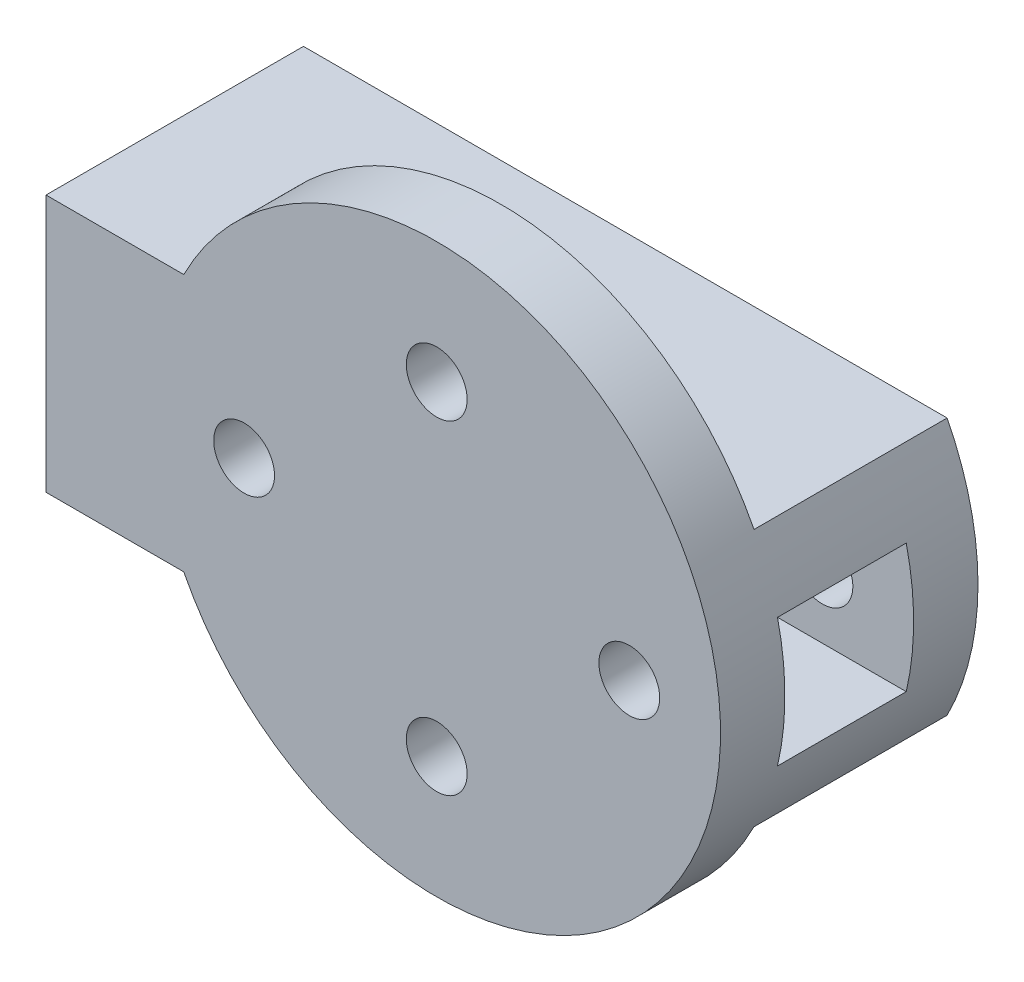
from build123d import *

# Parameters (mm, degrees)
SKETCH1_R           = 14
BOSS_EXTRUDE1_DEPTH = 3.175
BOSS_EXTRUDE2_START = 12.7
BOSS_EXTRUDE2_DEPTH = 12.7
SKETCH3_W           = 6.35
SKETCH3_H           = 6.35
CUT_EXTRUDE1_DEPTH  = 38.333803689
SKETCH4_R           = 1.5
CUT_EXTRUDE2_DEPTH  = 27.995101119


with BuildPart() as part:
    # Sketch1 → Boss-Extrude1 (new body)
    with BuildSketch(Plane.XY):
        Circle(SKETCH1_R)
    extrude(amount=BOSS_EXTRUDE1_DEPTH)

    # Sketch2 → Boss-Extrude2 (add)
    with BuildSketch(Plane(origin=(0, 0, 3.175), x_dir=(-1, 0, 0), z_dir=(0, 0, -1)).offset(BOSS_EXTRUDE2_START)):
        with BuildLine():
            Line((-12.477078985, 6.35), (19.272921015, 6.35))
            Line((19.272921015, 6.35), (19.272921015, -6.35))
            Line((19.272921015, -6.35), (-12.477078985, -6.35))
            ThreePointArc((-12.477078985, -6.35), (-14, 0), (-12.477078985, 6.35))
        make_face()
    extrude(amount=-BOSS_EXTRUDE2_DEPTH)

    # Sketch3 → Cut-Extrude1 (cut, through all)
    with BuildSketch(Plane.ZY.offset(19.272921015)):
        with Locations((-3.175, 0)):
            Rectangle(SKETCH3_W, SKETCH3_H)
    extrude(amount=-CUT_EXTRUDE1_DEPTH, mode=Mode.SUBTRACT)

    # Sketch4 → Cut-Extrude2 (cut, through all)
    with BuildSketch(Plane.XY.offset(3.175)):
        with Locations((-9.5, 0)):
            Circle(SKETCH4_R)
        with Locations(Location((9.5, 0, 0), (0, 0, 180))):
            Circle(SKETCH4_R)
        with Locations((0, 8)):
            Circle(SKETCH4_R)
        with Locations((0, -8)):
            Circle(SKETCH4_R)
    extrude(amount=-CUT_EXTRUDE2_DEPTH, mode=Mode.SUBTRACT)


solid = part.part
